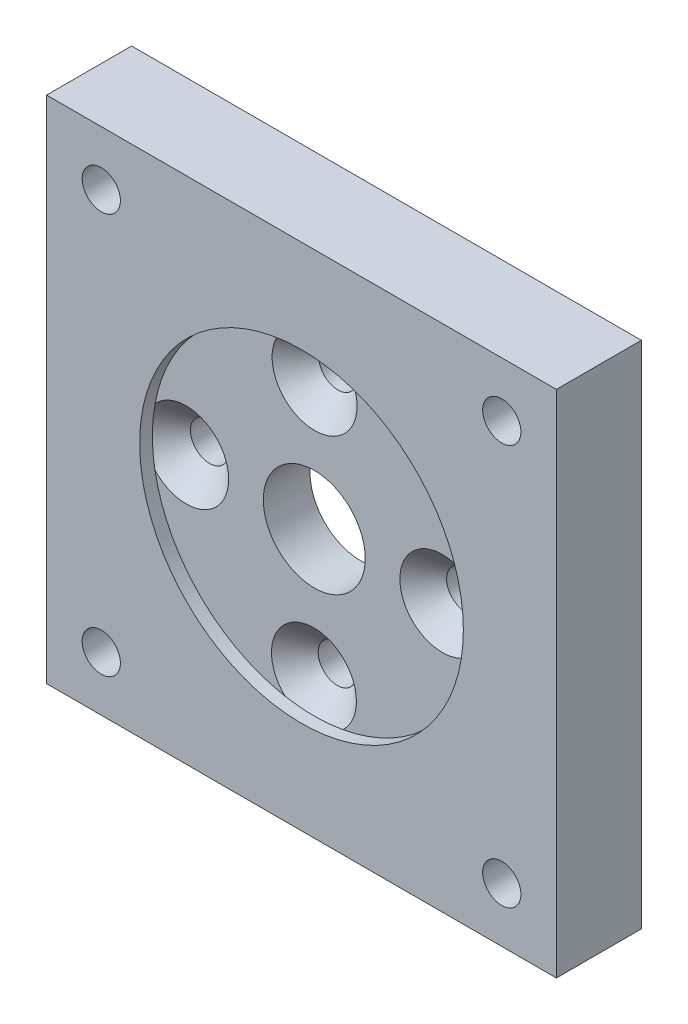
from build123d import *

# Parameters (mm, degrees)
SKETCH1_W                           = 60
SKETCH1_H                           = 60
BOSS_EXTRUDE1_DEPTH                 = 10
SKETCH2_R                           = 6
CUT_EXTRUDE1_DEPTH                  = 10
SKETCH3_R                           = 19.05
CUT_EXTRUDE2_DEPTH                  = 1.5
SKETCH4_R                           = 2.25
CUT_EXTRUDE3_DEPTH                  = 10
F_4_5_4_5_DIAMETER_HOLE1_AT_2_COUNT = 2
F_4_5_4_5_DIAMETER_HOLE1_AT_2_PITCH = 30.150470286
F_4_5_4_5_DIAMETER_HOLE1_AT_3_COUNT = 2
F_4_5_4_5_DIAMETER_HOLE1_AT_3_PITCH = 21.319601995
F_4_5_4_5_DIAMETER_HOLE1_AT_4_COUNT = 2
F_4_5_4_5_DIAMETER_HOLE1_AT_4_PITCH = 21.319601995
SKETCH6_R                           = 22.4
CUT_EXTRUDE4_DEPTH                  = 3


with BuildPart() as part:
    # Sketch1 → Boss-Extrude1 (new body)
    with BuildSketch(Plane.XY):
        Rectangle(SKETCH1_W, SKETCH1_H)
    extrude(amount=BOSS_EXTRUDE1_DEPTH)

    # Sketch2 → Cut-Extrude1 (cut)
    with BuildSketch(Plane.XY.offset(10)):
        Circle(SKETCH2_R)
    extrude(amount=-CUT_EXTRUDE1_DEPTH, mode=Mode.SUBTRACT)

    # Sketch3 → Cut-Extrude2 (cut)
    with BuildSketch(Plane.XY.offset(10)):
        Circle(SKETCH3_R)
    extrude(amount=-CUT_EXTRUDE2_DEPTH, mode=Mode.SUBTRACT)

    # Sketch4 → Cut-Extrude3 (cut)
    with BuildSketch(Plane.XY.offset(10)):
        with Locations((-23.57, 23.57)):
            Circle(SKETCH4_R)
        with Locations((23.57, 23.57)):
            Circle(SKETCH4_R)
        with Locations((23.57, -23.57)):
            Circle(SKETCH4_R)
        with Locations((-23.57, -23.57)):
            Circle(SKETCH4_R)
    extrude(amount=-CUT_EXTRUDE3_DEPTH, mode=Mode.SUBTRACT)

    # Sketch5 → Ø4.5 (4.5) Diameter Hole1 (revolve, cut)
    with BuildSketch(Plane(origin=(-15.075188443, 0.037523467, 8.5), x_dir=(0, -1, 0), z_dir=(1, 0, 0))):
        Polygon((0, 0), (0, 16.351936393), (2.25, 15), (2.25, 2.75), (5, 0), align=None)
    f_4_5_4_5_diameter_hole1 = revolve(axis=Axis((-15.075188443, 0.037523467, 14.85), (0, 0, -1)), mode=Mode.SUBTRACT)

    # Ø4.5 (4.5) Diameter Hole1 at 2: Ø4.5 (4.5) Diameter Hole1 ×2
    with Locations(*[Vector(0.9999969022354874, -0.0024890800366937364, 0) * (i * F_4_5_4_5_DIAMETER_HOLE1_AT_2_PITCH) for i in range(1, F_4_5_4_5_DIAMETER_HOLE1_AT_2_COUNT)]):
        add(f_4_5_4_5_diameter_hole1, mode=Mode.SUBTRACT)

    # Ø4.5 (4.5) Diameter Hole1 at 3: Ø4.5 (4.5) Diameter Hole1 ×2
    with Locations(*[Vector(0.7088646361091163, 0.705344545363392, 0) * (i * F_4_5_4_5_DIAMETER_HOLE1_AT_3_PITCH) for i in range(1, F_4_5_4_5_DIAMETER_HOLE1_AT_3_COUNT)]):
        add(f_4_5_4_5_diameter_hole1, mode=Mode.SUBTRACT)

    # Ø4.5 (4.5) Diameter Hole1 at 4: Ø4.5 (4.5) Diameter Hole1 ×2
    with Locations(*[Vector(0.705344545363392, -0.7088646361091163, 0) * (i * F_4_5_4_5_DIAMETER_HOLE1_AT_4_PITCH) for i in range(1, F_4_5_4_5_DIAMETER_HOLE1_AT_4_COUNT)]):
        add(f_4_5_4_5_diameter_hole1, mode=Mode.SUBTRACT)

    # Sketch6 → Cut-Extrude4 (cut)
    with BuildSketch(Plane(origin=(0, 0, 0), x_dir=(-1, 0, 0), z_dir=(0, 0, -1))):
        Circle(SKETCH6_R)
    extrude(amount=-CUT_EXTRUDE4_DEPTH, mode=Mode.SUBTRACT)


solid = part.part
